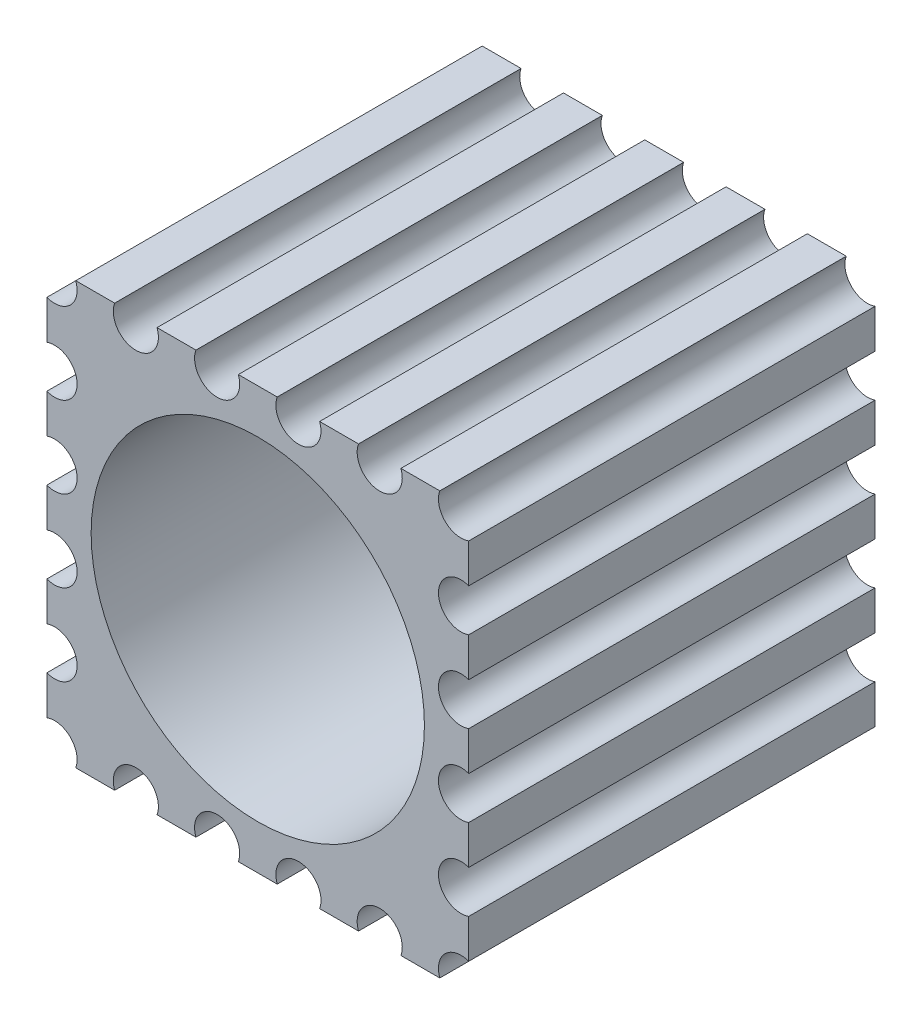
from build123d import *

# Parameters (mm, degrees)
SKETCH2_R           = 4.1
BOSS_EXTRUDE2_DEPTH = 10


with BuildPart() as part:
    # Sketch2 → Boss-Extrude2 (new body)
    with BuildSketch(Plane.XY):
        with BuildLine():
            ThreePointArc((-8.388352144, 2.232508627), (-7.643352144, 2.753972912), (-8.388352144, 3.275437196))
            Line((-8.388352144, 3.275437196), (-8.388352144, 4.232508627))
            ThreePointArc((-8.388352144, 4.232508627), (-7.805907881, 4.361528648), (-7.67688786, 4.943972912))
            Line((-7.67688786, 4.943972912), (-6.719816429, 4.943972912))
            ThreePointArc((-6.719816429, 4.943972912), (-6.198352144, 4.198972912), (-5.67688786, 4.943972912))
            Line((-5.67688786, 4.943972912), (-4.719816429, 4.943972912))
            ThreePointArc((-4.719816429, 4.943972912), (-4.198352144, 4.198972912), (-3.67688786, 4.943972912))
            Line((-3.67688786, 4.943972912), (-2.719816429, 4.943972912))
            ThreePointArc((-2.719816429, 4.943972912), (-2.198352144, 4.198972912), (-1.67688786, 4.943972912))
            Line((-1.67688786, 4.943972912), (-0.719816429, 4.943972912))
            ThreePointArc((-0.719816429, 4.943972912), (-0.198352144, 4.198972912), (0.32311214, 4.943972912))
            Line((0.32311214, 4.943972912), (1.280183571, 4.943972912))
            ThreePointArc((1.280183571, 4.943972912), (1.409203592, 4.361528648), (1.991647856, 4.232508627))
            Line((1.991647856, 4.232508627), (1.991647856, 3.275437196))
            ThreePointArc((1.991647856, 3.275437196), (1.246647856, 2.753972912), (1.991647856, 2.232508627))
            Line((1.991647856, 2.232508627), (1.991647856, 1.275437196))
            ThreePointArc((1.991647856, 1.275437196), (1.246647856, 0.753972912), (1.991647856, 0.232508627))
            Line((1.991647856, 0.232508627), (1.991647856, -0.724562804))
            ThreePointArc((1.991647856, -0.724562804), (1.246647856, -1.246027088), (1.991647856, -1.767491373))
            Line((1.991647856, -1.767491373), (1.991647856, -2.724562804))
            ThreePointArc((1.991647856, -2.724562804), (1.246647856, -3.246027088), (1.991647856, -3.767491373))
            Line((1.991647856, -3.767491373), (1.991647856, -4.724562804))
            ThreePointArc((1.991647856, -4.724562804), (1.409203592, -4.853582824), (1.280183571, -5.436027088))
            Line((1.280183571, -5.436027088), (0.32311214, -5.436027088))
            ThreePointArc((0.32311214, -5.436027088), (-0.198352144, -4.691027088), (-0.719816429, -5.436027088))
            Line((-0.719816429, -5.436027088), (-1.67688786, -5.436027088))
            ThreePointArc((-1.67688786, -5.436027088), (-2.198352144, -4.691027088), (-2.719816429, -5.436027088))
            Line((-2.719816429, -5.436027088), (-3.67688786, -5.436027088))
            ThreePointArc((-3.67688786, -5.436027088), (-4.198352144, -4.691027088), (-4.719816429, -5.436027088))
            Line((-4.719816429, -5.436027088), (-5.67688786, -5.436027088))
            ThreePointArc((-5.67688786, -5.436027088), (-6.198352144, -4.691027088), (-6.719816429, -5.436027088))
            Line((-6.719816429, -5.436027088), (-7.67688786, -5.436027088))
            ThreePointArc((-7.67688786, -5.436027088), (-7.805907881, -4.853582824), (-8.388352144, -4.724562804))
            Line((-8.388352144, -4.724562804), (-8.388352144, -3.767491373))
            ThreePointArc((-8.388352144, -3.767491373), (-7.643352144, -3.246027088), (-8.388352144, -2.724562804))
            Line((-8.388352144, -2.724562804), (-8.388352144, -1.767491373))
            ThreePointArc((-8.388352144, -1.767491373), (-7.643352144, -1.246027088), (-8.388352144, -0.724562804))
            Line((-8.388352144, -0.724562804), (-8.388352144, 0.232508627))
            ThreePointArc((-8.388352144, 0.232508627), (-7.643352144, 0.753972912), (-8.388352144, 1.275437196))
            Line((-8.388352144, 1.275437196), (-8.388352144, 2.232508627))
        make_face()
        with Locations((-3.198352144, -0.246027088)):
            Circle(SKETCH2_R, mode=Mode.SUBTRACT)
    extrude(amount=BOSS_EXTRUDE2_DEPTH)


solid = part.part
